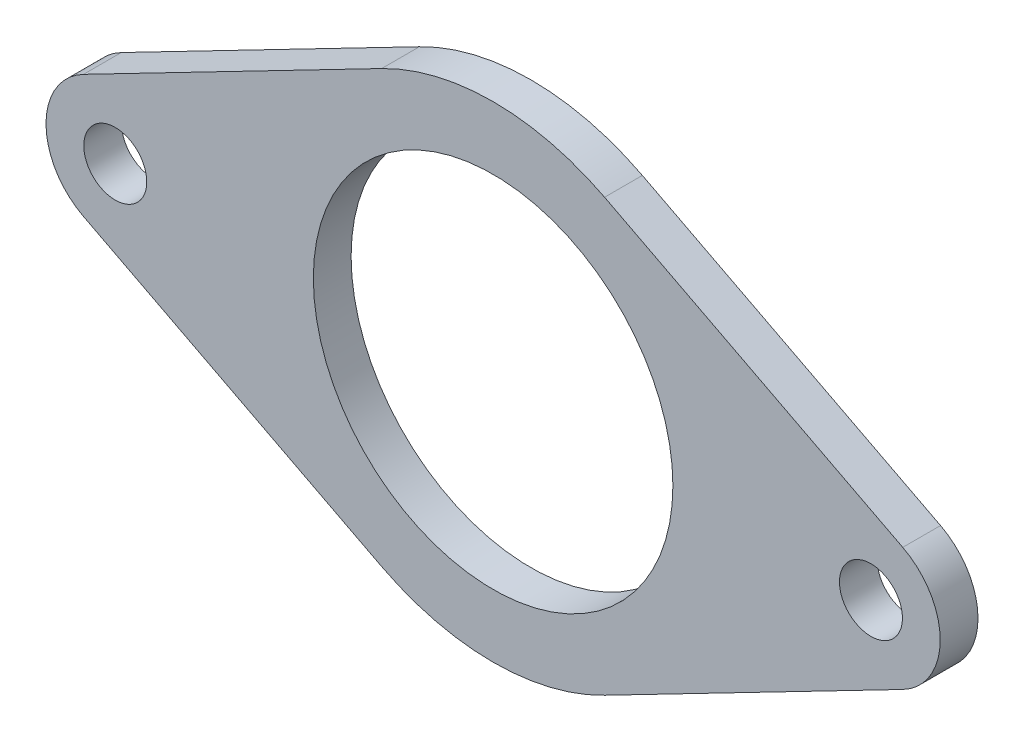
from build123d import *

# Parameters (mm, degrees)
SKETCH1_R           = 14.2748
SKETCH1_R_2         = 2.5
BOSS_EXTRUDE1_DEPTH = 3


with BuildPart() as part:
    # Sketch1 → Boss-Extrude1 (new body)
    with BuildSketch(Plane.XY):
        with BuildLine():
            ThreePointArc((8.850217168, 17.122837706), (0, 19.2748), (-8.850217168, 17.122837706))
            Line((-8.850217168, 17.122837706), (-32.52538, 4.885944725))
            ThreePointArc((-32.52538, 4.885944725), (-35.5, 0), (-32.52538, -4.885944725))
            Line((-32.52538, -4.885944725), (-8.850217168, -17.122837706))
            ThreePointArc((-8.850217168, -17.122837706), (0, -19.2748), (8.850217168, -17.122837706))
            Line((8.850217168, -17.122837706), (32.52538, -4.885944725))
            ThreePointArc((32.52538, -4.885944725), (35.5, 0), (32.52538, 4.885944725))
            Line((32.52538, 4.885944725), (8.850217168, 17.122837706))
        make_face()
        Circle(SKETCH1_R, mode=Mode.SUBTRACT)
        with Locations((-30, 0)):
            Circle(SKETCH1_R_2, mode=Mode.SUBTRACT)
        with Locations((30, 0)):
            Circle(SKETCH1_R_2, mode=Mode.SUBTRACT)
    extrude(amount=BOSS_EXTRUDE1_DEPTH)


solid = part.part
